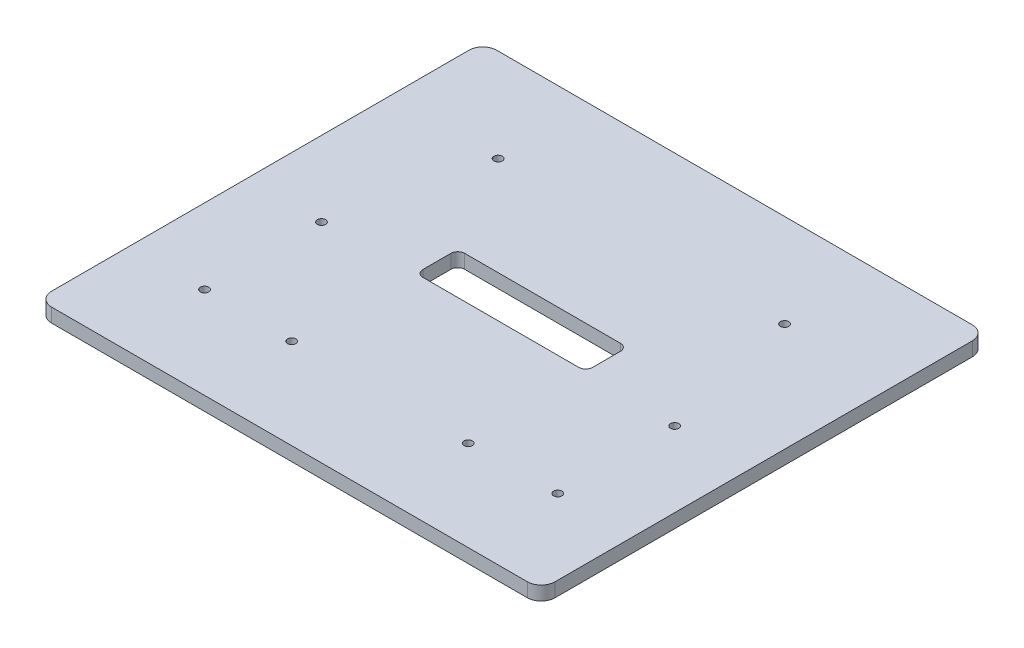
from build123d import *

# Parameters (mm, degrees)
RESSALTO_EXTRUS_O1_DEPTH = 5
ESBO_O2_R                = 1.5
CORTE_EXTRUS_O1_DEPTH    = 5
ESBO_O3_R                = 1.5
CORTE_EXTRUS_O2_DEPTH    = 10
CORTE_EXTRUS_O3_DEPTH    = 10


with BuildPart() as part:
    # Esboço1 → Ressalto-extrusão1 (new body)
    with BuildSketch(Plane(origin=(0, 0, 0), x_dir=(1, 0, 0), z_dir=(0, 1, 0))):
        with BuildLine():
            Line((-61.865783789, 131.661644013), (109.134216211, 131.661644013))
            ThreePointArc((109.134216211, 131.661644013), (112.669750117, 130.197177919), (114.134216211, 126.661644013))
            Line((114.134216211, 126.661644013), (114.134216211, -23.338355987))
            ThreePointArc((114.134216211, -23.338355987), (112.669750117, -26.873889893), (109.134216211, -28.338355987))
            Line((109.134216211, -28.338355987), (-61.865783789, -28.338355987))
            ThreePointArc((-61.865783789, -28.338355987), (-65.401317695, -26.873889893), (-66.865783789, -23.338355987))
            Line((-66.865783789, -23.338355987), (-66.865783789, 126.661644013))
            ThreePointArc((-66.865783789, 126.661644013), (-65.401317695, 130.197177919), (-61.865783789, 131.661644013))
        make_face()
    extrude(amount=RESSALTO_EXTRUS_O1_DEPTH)

    # Esboço2 → Corte-extrusão1 (cut)
    with BuildSketch(Plane(origin=(0, 5, 0), x_dir=(1, 0, 0), z_dir=(0, 1, 0))):
        with Locations(Location((-27.865783789, 98.161644013, 0), (0, 0, 270))):
            Circle(ESBO_O2_R)
        with Locations(Location((75.134216211, 98.161644013, 0), (0, 0, 270))):
            Circle(ESBO_O2_R)
        with Locations(Location((-8.115783789, 4.161644013, 0), (0, 0, 270))):
            Circle(ESBO_O2_R)
        with Locations(Location((55.384216211, 4.161644013, 0), (0, 0, 270))):
            Circle(ESBO_O2_R)
    extrude(amount=-CORTE_EXTRUS_O1_DEPTH, mode=Mode.SUBTRACT)

    # Esboço3 → Corte-extrusão2 (cut)
    with BuildSketch(Plane(origin=(0, 5, 0), x_dir=(1, 0, 0), z_dir=(0, 1, 0))):
        with Locations(Location((-39.865783789, 46.661644013, 0), (0, 0, 270))):
            Circle(ESBO_O3_R)
        with Locations(Location((-39.865783789, 4.611644013, 0), (0, 0, 270))):
            Circle(ESBO_O3_R)
        with Locations(Location((87.134216211, 46.661644013, 0), (0, 0, 270))):
            Circle(ESBO_O3_R)
        with Locations(Location((87.134216211, 4.611644013, 0), (0, 0, 270))):
            Circle(ESBO_O3_R)
    extrude(amount=-CORTE_EXTRUS_O2_DEPTH, mode=Mode.SUBTRACT)

    # Esboço4 → Corte-extrusão3 (cut)
    with BuildSketch(Plane(origin=(0, 5, 0), x_dir=(1, 0, 0), z_dir=(0, 1, 0))):
        with BuildLine():
            Line((-4.365783789, 62.661644013), (51.634216211, 62.661644013))
            ThreePointArc((51.634216211, 62.661644013), (53.401983164, 61.929410966), (54.134216211, 60.161644013))
            Line((54.134216211, 60.161644013), (54.134216211, 50.161644013))
            ThreePointArc((54.134216211, 50.161644013), (53.401983164, 48.39387706), (51.634216211, 47.661644013))
            Line((51.634216211, 47.661644013), (-4.365783789, 47.661644013))
            ThreePointArc((-4.365783789, 47.661644013), (-6.133550742, 48.39387706), (-6.865783789, 50.161644013))
            Line((-6.865783789, 50.161644013), (-6.865783789, 60.161644013))
            ThreePointArc((-6.865783789, 60.161644013), (-6.133550742, 61.929410966), (-4.365783789, 62.661644013))
        make_face()
    extrude(amount=-CORTE_EXTRUS_O3_DEPTH, mode=Mode.SUBTRACT)


solid = part.part
